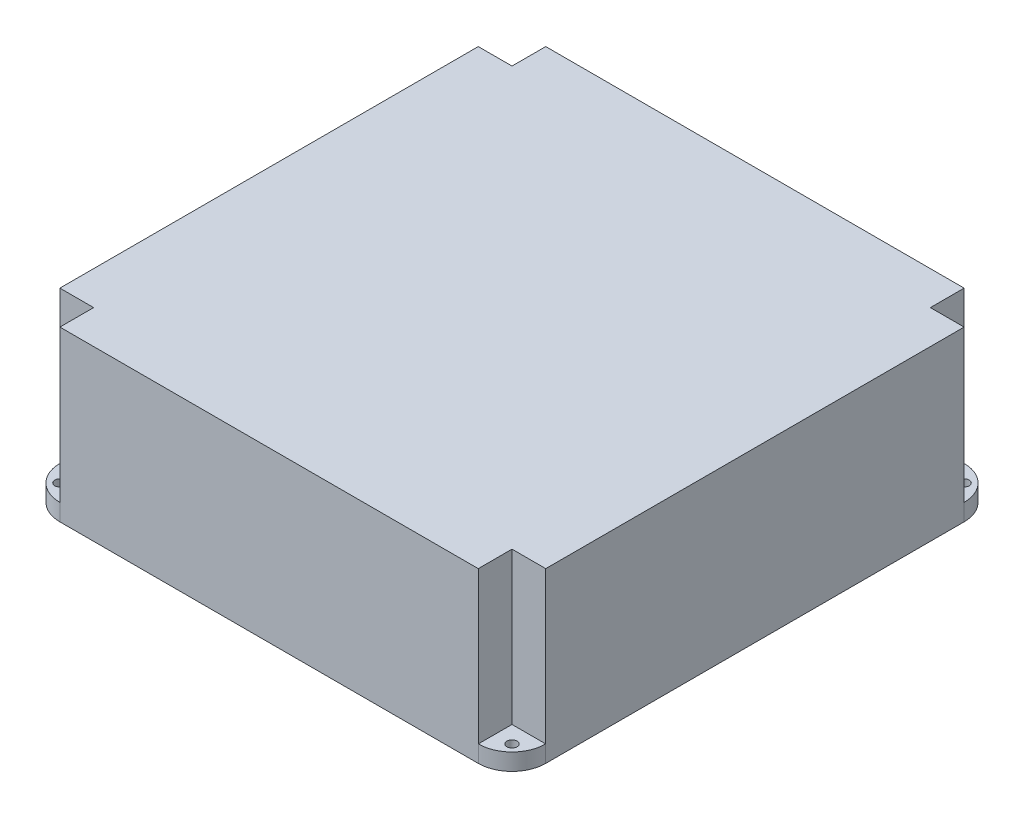
from build123d import *

# Parameters (mm, degrees)
BOSS_EXTRUDE1_DEPTH = 45
BOSS_EXTRUDE2_DEPTH = 5
SKETCH4_W           = 5
SKETCH4_H           = 5
SKETCH4_H_2         = 15
SKETCH4_W_2         = 13.596951961
CUT_EXTRUDE2_DEPTH  = 45
SKETCH5_R           = 5
CUT_EXTRUDE3_DEPTH  = 45
SKETCH6_R           = 1
CUT_EXTRUDE4_DEPTH  = 10
BOSS_EXTRUDE3_DEPTH = 5
SKETCH9_R           = 1.5
CUT_EXTRUDE5_DEPTH  = 5


with BuildPart() as part:
    # Sketch1 → Boss-Extrude1 (new body)
    with BuildSketch(Plane(origin=(0, 0, 0), x_dir=(1, 0, 0), z_dir=(0, 1, 0))):
        Polygon((-62, 72), (62, 72), (62, 62), (72, 62), (72, -62), (62, -62), (62, -72), (-62, -72), (-62, -62), (-72, -62), (-72, 62), (-62, 62), align=None)
        Polygon((-62, 52), (-62, -52), (-52, -52), (-52, -62), (52, -62), (52, -52), (62, -52), (62, 52), (52, 52), (52, 62), (-52, 62), (-52, 52), align=None, mode=Mode.SUBTRACT)
    extrude(amount=BOSS_EXTRUDE1_DEPTH)

    # Sketch2 → Boss-Extrude2 (add)
    with BuildSketch(Plane(origin=(0, 45, 0), x_dir=(1, 0, 0), z_dir=(0, 1, 0))):
        Polygon((-62, 72), (62, 72), (62, 62), (72, 62), (72, -62), (62, -62), (62, -72), (-62, -72), (-62, -62), (-72, -62), (-72, 62), (-62, 62), align=None)
    extrude(amount=BOSS_EXTRUDE2_DEPTH)

    # Sketch4 → Cut-Extrude2 (cut)
    with BuildSketch(Plane.XZ):
        with Locations((54.5, 54.5)):
            Rectangle(SKETCH4_W, SKETCH4_H)
        with Locations((-64.5, 7.5)):
            Rectangle(SKETCH4_W, SKETCH4_H_2)
        with Locations((58.798475981, -54.5)):
            Rectangle(SKETCH4_W_2, SKETCH4_H)
    extrude(amount=-CUT_EXTRUDE2_DEPTH, mode=Mode.SUBTRACT)

    # Sketch5 → Cut-Extrude3 (cut)
    with BuildSketch(Plane.XZ):
        with Locations((11.02, -60.75)):
            Circle(SKETCH5_R)
    extrude(amount=-CUT_EXTRUDE3_DEPTH, mode=Mode.SUBTRACT)

    # Sketch6 → Cut-Extrude4 (cut)
    with BuildSketch(Plane.XZ):
        with Locations(Location((0, 66.667049072, 0), (0, 0, 270))):
            Circle(SKETCH6_R)
        with Locations(Location((0, -66.67, 0), (0, 0, 270))):
            Circle(SKETCH6_R)
    extrude(amount=-CUT_EXTRUDE4_DEPTH, mode=Mode.SUBTRACT)

    # Sketch8 → Boss-Extrude3 (add)
    with BuildSketch(Plane(origin=(0, 0, 0), x_dir=(-1, 0, 0), z_dir=(0, -1, 0))):
        with BuildLine():
            Line((62, 72), (62, 62))
            Line((62, 62), (72, 62))
            ThreePointArc((72, 62), (69.071067812, 69.071067812), (62, 72))
        make_face()
        with BuildLine():
            Line((62, -72), (62, -62))
            Line((62, -62), (72, -62))
            ThreePointArc((72, -62), (69.071067812, -69.071067812), (62, -72))
        make_face()
        with BuildLine():
            Line((-62, -62), (-72, -62))
            ThreePointArc((-72, -62), (-69.071067812, -69.071067812), (-62, -72))
            Line((-62, -72), (-62, -62))
        make_face()
        with BuildLine():
            Line((-62, 62), (-72, 62))
            ThreePointArc((-72, 62), (-69.071067812, 69.071067812), (-62, 72))
            Line((-62, 72), (-62, 62))
        make_face()
    extrude(amount=-BOSS_EXTRUDE3_DEPTH)

    # Sketch9 → Cut-Extrude5 (cut)
    with BuildSketch(Plane(origin=(0, 5, 0), x_dir=(1, 0, 0), z_dir=(0, 1, 0))):
        with Locations(Location((-67, -67, 0), (0, 0, 270))):
            Circle(SKETCH9_R)
        with Locations(Location((67, -67, 0), (0, 0, 90))):
            Circle(SKETCH9_R)
        with Locations(Location((67, 67, 0), (0, 0, 270))):
            Circle(SKETCH9_R)
        with Locations(Location((-67, 67, 0), (0, 0, 90))):
            Circle(SKETCH9_R)
    extrude(amount=-CUT_EXTRUDE5_DEPTH, mode=Mode.SUBTRACT)


solid = part.part
